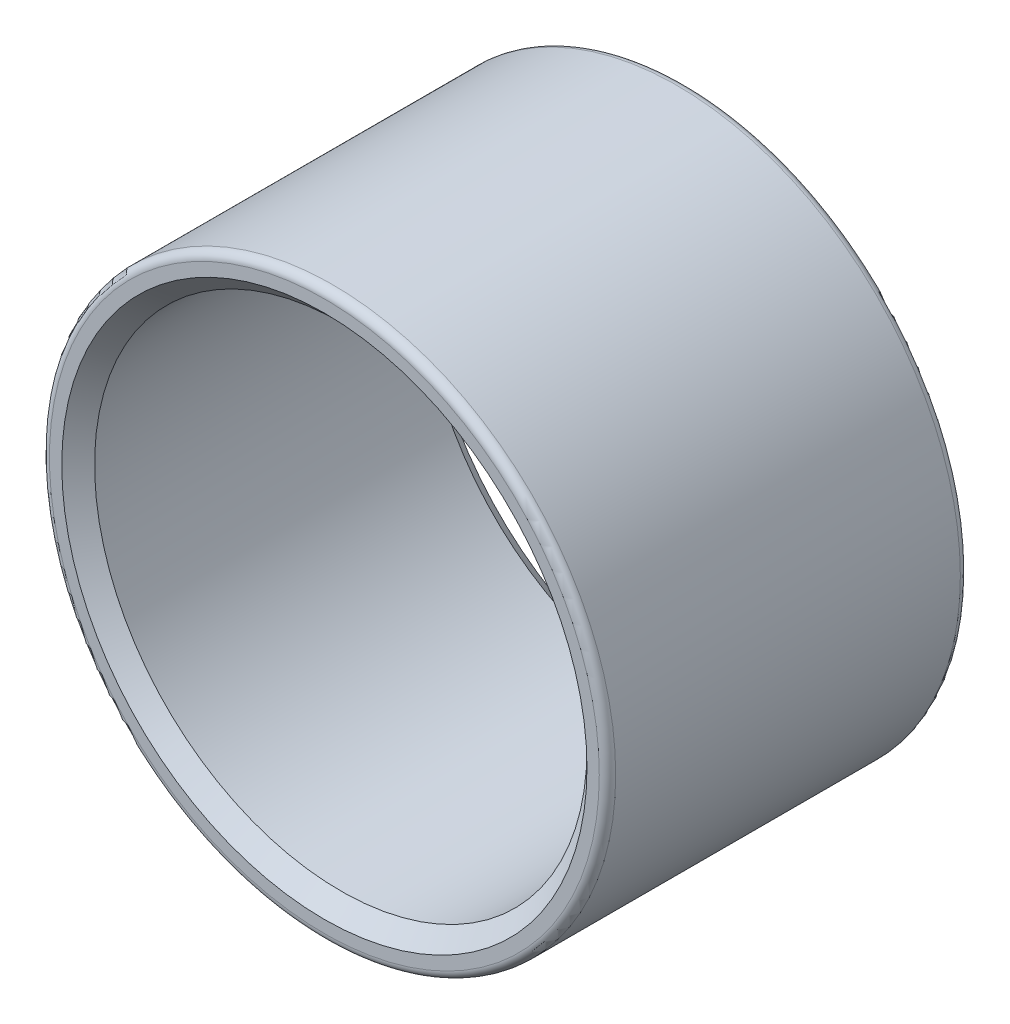
from build123d import *

# Parameters (mm, degrees)
ESQUISSE1_R          = 17.25
ESQUISSE1_R_2        = 15
BASE_EXTRUSION_DEPTH = 22
CONG_1_R             = 0.5
CHANFREIN1_SIZE      = 1


with BuildPart() as part:
    # Esquisse1 → Base-Extrusion (new body)
    with BuildSketch(Plane.XY):
        Circle(ESQUISSE1_R)
        Circle(ESQUISSE1_R_2, mode=Mode.SUBTRACT)
    extrude(amount=BASE_EXTRUSION_DEPTH)

    # Congé1
    cong_1_edges = [part.edges().sort_by_distance(p)[0] for p in [
        (-17.25, 0, 0),
        (-17.25, 0, 22),
    ]]
    fillet(cong_1_edges, radius=CONG_1_R)

    # Chanfrein1
    chanfrein1_edges = [part.edges().sort_by_distance(p)[0] for p in [
        (-15, 0, 0),
        (-15, 0, 22),
    ]]
    chamfer(chanfrein1_edges, length=CHANFREIN1_SIZE)


solid = part.part
